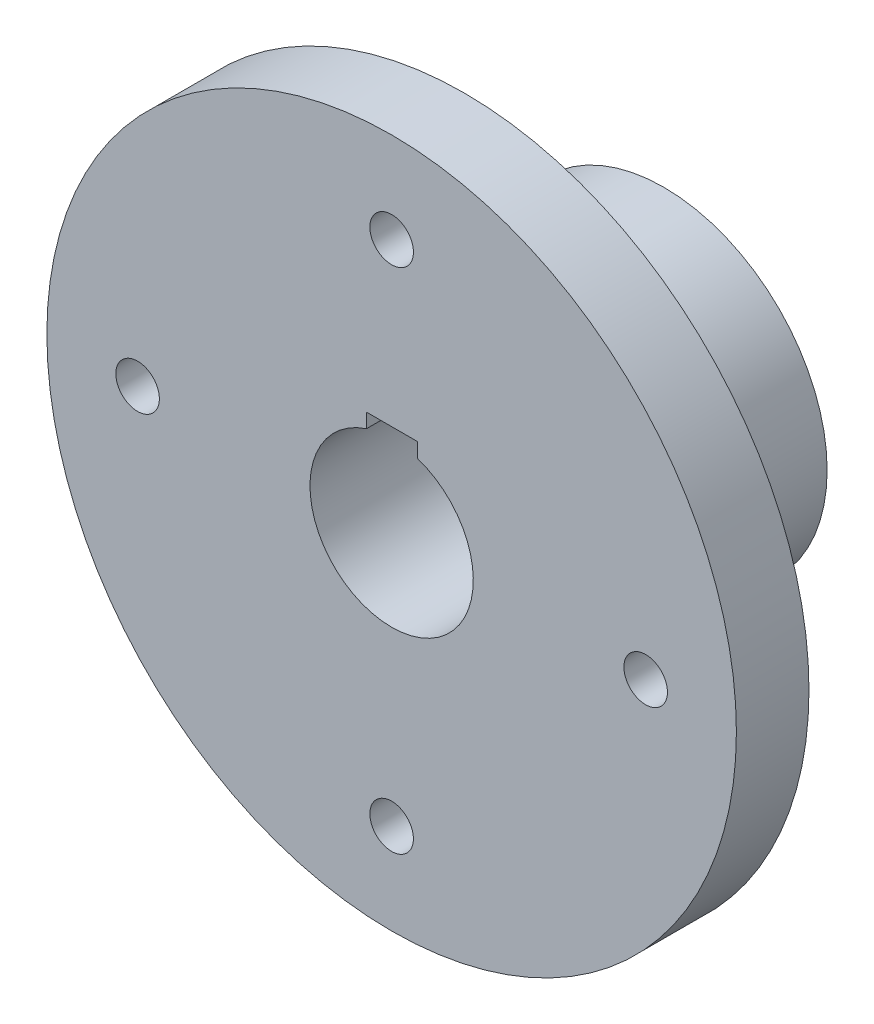
from build123d import *

# Parameters (mm, degrees)
SKETCH1_R           = 95
BOSS_EXTRUDE1_DEPTH = 20
SKETCH2_R           = 6
CUT_EXTRUDE1_DEPTH  = 20
SKETCH5_R           = 45
BOSS_EXTRUDE3_DEPTH = 55
CUT_EXTRUDE2_DEPTH  = 75


with BuildPart() as part:
    # Sketch1 → Boss-Extrude1 (new body)
    with BuildSketch(Plane.XY):
        Circle(SKETCH1_R)
    extrude(amount=BOSS_EXTRUDE1_DEPTH)

    # Sketch2 → Cut-Extrude1 (cut)
    with BuildSketch(Plane.XY.offset(20)):
        with Locations((0, 70)):
            Circle(SKETCH2_R)
        with Locations((70, 0)):
            Circle(SKETCH2_R)
        with Locations(Location((0, -70, 0), (0, 0, 180))):
            Circle(SKETCH2_R)
        with Locations(Location((-70, 0, 0), (0, 0, 180))):
            Circle(SKETCH2_R)
    extrude(amount=-CUT_EXTRUDE1_DEPTH, mode=Mode.SUBTRACT)

    # Sketch5 → Boss-Extrude3 (add)
    with BuildSketch(Plane(origin=(0, 0, 0), x_dir=(-1, 0, 0), z_dir=(0, 0, -1))):
        with Locations(Location((0, 0, 0), (0, 0, 180))):
            Circle(SKETCH5_R)
    extrude(amount=BOSS_EXTRUDE3_DEPTH)

    # Sketch3 → Cut-Extrude2 (cut)
    with BuildSketch(Plane.XY.offset(20)):
        with BuildLine():
            Line((-6.940265993, 22.474071895), (-6.940265993, 21.402866816))
            ThreePointArc((-6.940265993, 21.402866816), (-0.062853214, -22.49991221), (7.059734007, 21.363757997))
            Line((7.059734007, 21.363757997), (7.059734007, 22.474071895))
            Line((7.059734007, 22.474071895), (7.059734007, 25.374071895))
            Line((7.059734007, 25.374071895), (-6.940265993, 25.374071895))
            Line((-6.940265993, 25.374071895), (-6.940265993, 22.474071895))
        make_face()
    extrude(amount=-CUT_EXTRUDE2_DEPTH, mode=Mode.SUBTRACT)


solid = part.part
